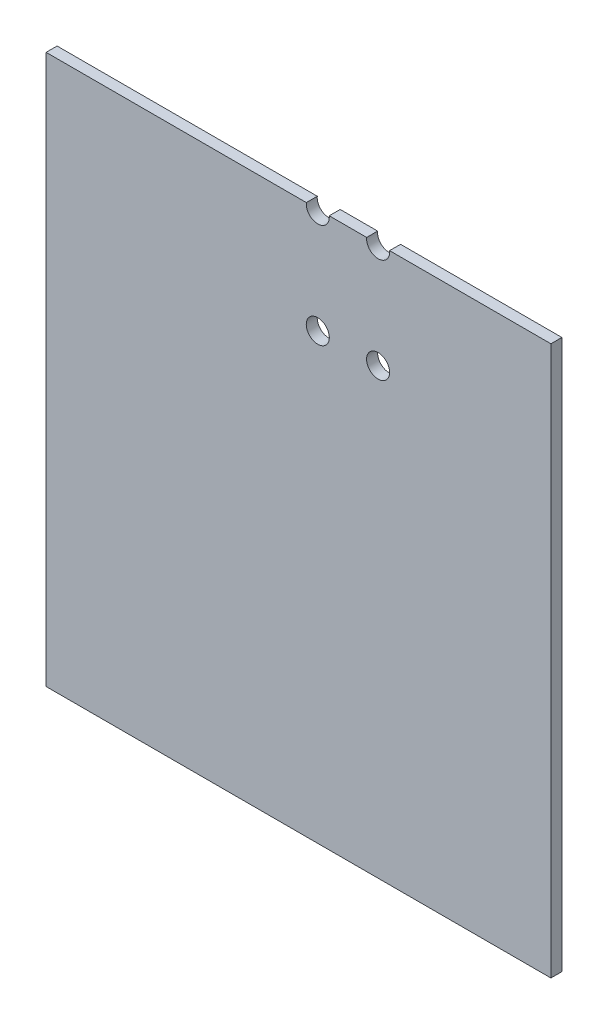
from build123d import *

# Parameters (mm, degrees)
SCHIZZO1_W                   = 184
SCHIZZO1_H                   = 200.217102587
ESTRUSIONE_ESTRUSIONE1_DEPTH = 4
M8_CLEARANCE_HOLE2_D         = 8.4


with BuildPart() as part:
    # Schizzo1 → Estrusione-Estrusione1 (new body)
    with BuildSketch(Plane.XY.offset(218.103339909)):
        with Locations((62.879048982, -170.411757868)):
            Rectangle(SCHIZZO1_W, SCHIZZO1_H)
    extrude(amount=ESTRUSIONE_ESTRUSIONE1_DEPTH)

    # M8 Clearance Hole2 (through all)
    with Locations(Plane(origin=(0, 0, 218.103339909), x_dir=(1, 0, 0), z_dir=(0, 0, -1))):
        with Locations((91.897840875, 70.752400597), (69.897840875, 70.752400597), (91.897840875, 108.752400597), (69.897840875, 108.752400597)):
            Hole(M8_CLEARANCE_HOLE2_D / 2)


solid = part.part
